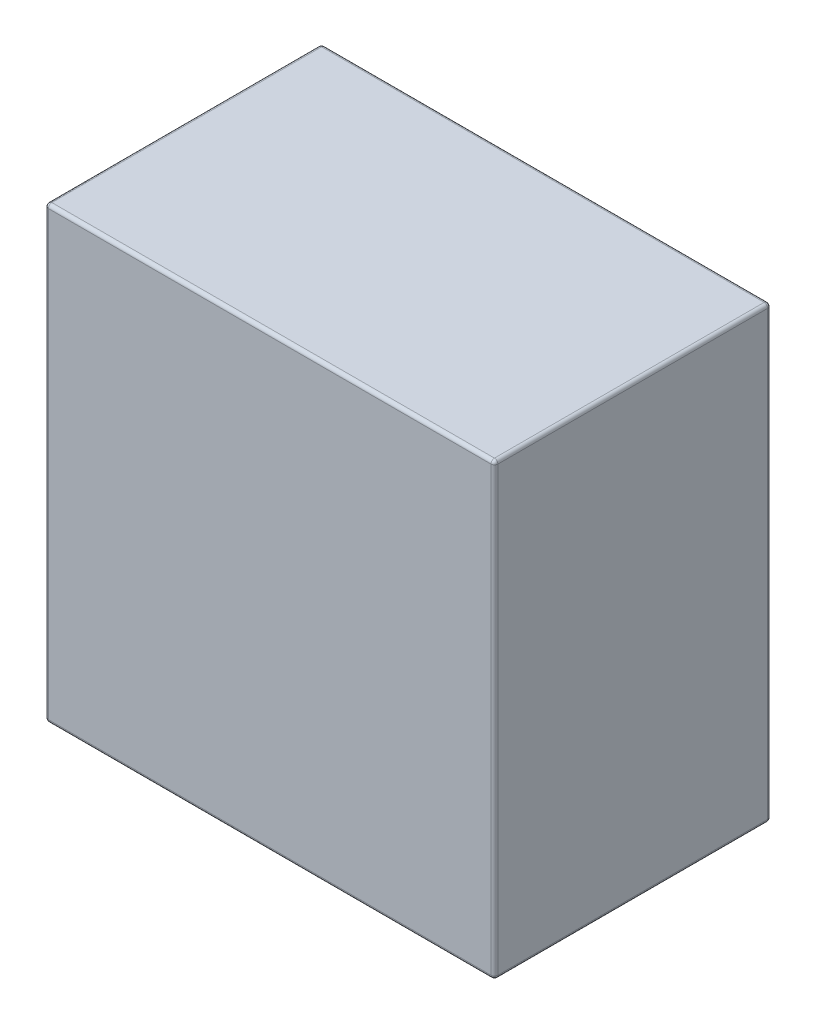
from build123d import *

# Parameters (mm, degrees)
SKETCH1_W           = 13
SKETCH1_H           = 13
BOSS_EXTRUDE1_DEPTH = 8
FILLET1_R           = 0.1


with BuildPart() as part:
    # Sketch1 → Boss-Extrude1 (new body)
    with BuildSketch(Plane(origin=(0, 0, 0), x_dir=(0, 1, 0), z_dir=(0, 0, 1))):
        Rectangle(SKETCH1_W, SKETCH1_H)
    extrude(amount=BOSS_EXTRUDE1_DEPTH)

    # Fillet1
    fillet1_edges = [part.edges().sort_by_distance(p)[0] for p in [
        (0, -6.5, 8),
        (6.5, 0, 8),
        (0, 6.5, 8),
        (6.5, 0, 0),
        (0, -6.5, 0),
        (-6.5, 0, 0),
        (0, 6.5, 0),
        (6.5, 6.5, 4),
        (6.5, -6.5, 4),
        (-6.5, -6.5, 4),
        (-6.5, 6.5, 4),
        (-6.5, 0, 8),
    ]]
    fillet(fillet1_edges, radius=FILLET1_R)


solid = part.part
